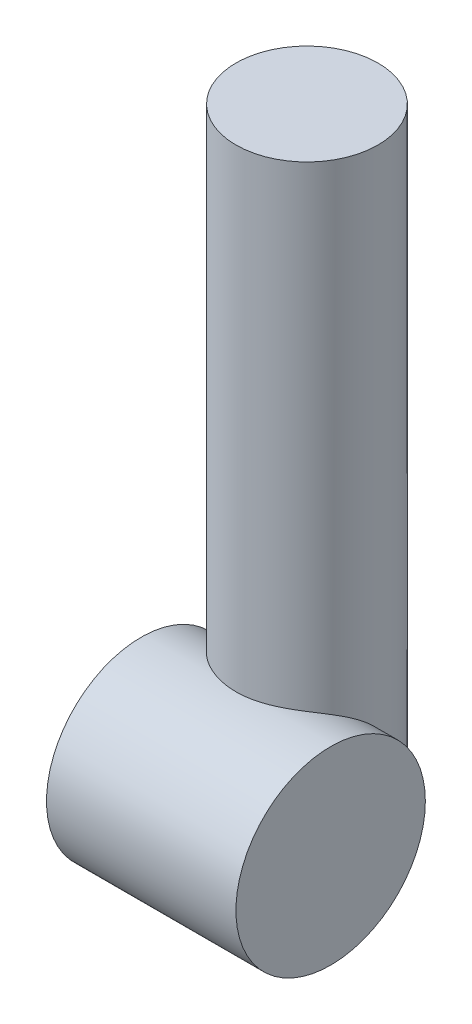
from build123d import *

# Parameters (mm, degrees)
SKETCH_1_R      = 30
EXTRUDE_1_DEPTH = 240
SKETCH_2_R      = 40
EXTRUDE_2_DEPTH = 40


with BuildPart() as part:
    # 草图1 → 凸台-拉伸1 (new body)
    with BuildSketch(Plane(origin=(0, 0, 0), x_dir=(1, 0, 0), z_dir=(0, 1, 0))):
        with Locations(Location((0, 0, 0), (0, 0, 270))):
            Circle(SKETCH_1_R)
    extrude(amount=EXTRUDE_1_DEPTH)

    # 草图2 → 凸台-拉伸2 (add, symmetric)
    with BuildSketch(Plane(origin=(0, 0, 0), x_dir=(0, 0, -1), z_dir=(1, 0, 0))):
        with Locations((-30, 0)):
            Circle(SKETCH_2_R)
    extrude(amount=EXTRUDE_2_DEPTH, both=True)


solid = part.part
